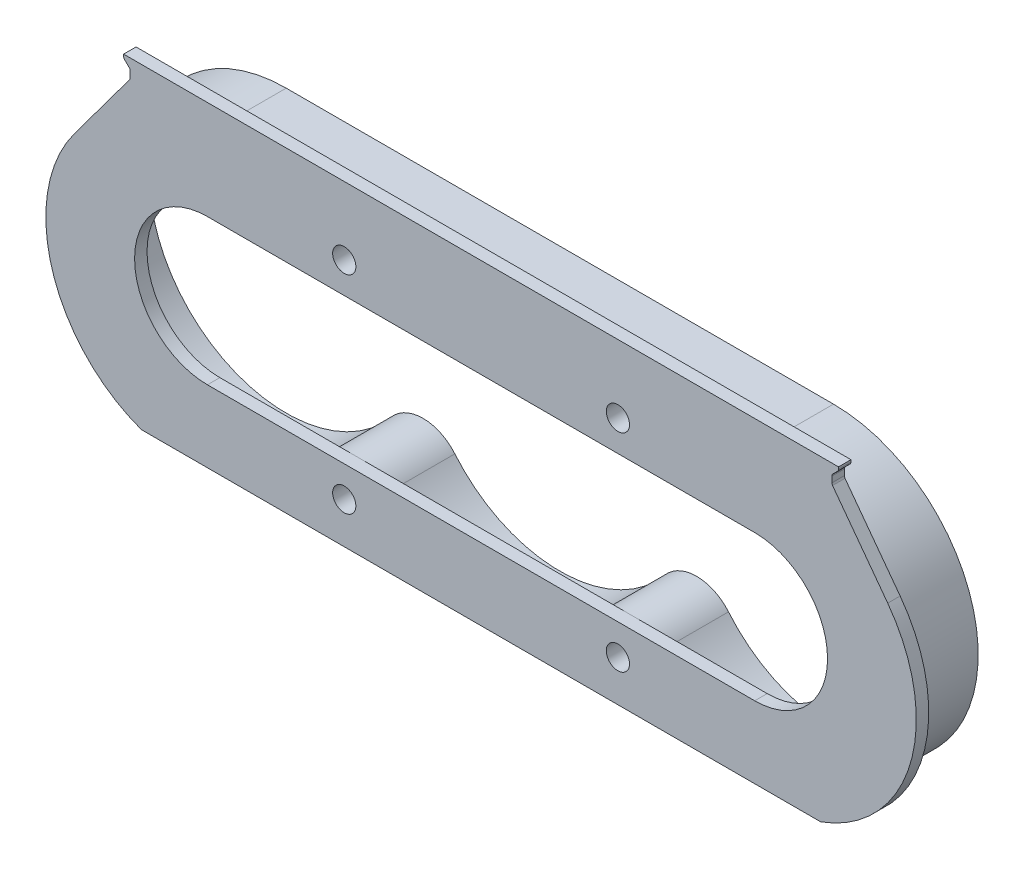
from build123d import *

# Parameters (mm, degrees)
SKETCH1_R               = 1.2
BOSS_EXTRUDE1_DEPTH     = 8
BOSS_EXTRUDE2_DEPTH     = 1.5
CUT_EXTRUDE1_DEPTH      = 125.252015178
CUT_EXTRUDE1_DEPTH_BACK = 125.252015178
SKETCH3_R               = 1.4
CUT_EXTRUDE2_DEPTH      = 125.252015178
SKETCH5_W               = 117.271867341
SKETCH5_H               = 6.016252737
CUT_EXTRUDE3_DEPTH      = 125.252015178


with BuildPart() as part:
    # Sketch1 → Boss-Extrude1 (new body)
    with BuildSketch(Plane.XY):
        with BuildLine():
            Line((32.794822831, -0.95), (98.794822831, -0.95))
            ThreePointArc((98.794822831, -0.95), (116.244822831, 16.5), (98.794822831, 33.95))
            Line((98.794822831, 33.95), (32.794822831, 33.95))
            ThreePointArc((32.794822831, 33.95), (15.344822831, 16.5), (32.794822831, -0.95))
        make_face()
        with Locations((82.294822831, 29)):
            Circle(SKETCH1_R, mode=Mode.SUBTRACT)
        with Locations((49.294822831, 4)):
            Circle(SKETCH1_R, mode=Mode.SUBTRACT)
        with Locations((82.294822831, 4)):
            Circle(SKETCH1_R, mode=Mode.SUBTRACT)
        with Locations((49.294822831, 29)):
            Circle(SKETCH1_R, mode=Mode.SUBTRACT)
        with BuildLine():
            ThreePointArc((86.132032133, 5.921543981), (82.294822831, 7.715951248), (78.457613529, 5.921543981))
            ThreePointArc((78.457613529, 5.921543981), (65.794822831, 0), (53.132032133, 5.921543981))
            ThreePointArc((53.132032133, 5.921543981), (49.294822831, 7.715951248), (45.457613529, 5.921543981))
            ThreePointArc((45.457613529, 5.921543981), (16.294822831, 16.5), (45.457613529, 27.078456019))
            ThreePointArc((45.457613529, 27.078456019), (49.294822831, 25.284048752), (53.132032133, 27.078456019))
            ThreePointArc((53.132032133, 27.078456019), (65.794822831, 33), (78.457613529, 27.078456019))
            ThreePointArc((78.457613529, 27.078456019), (82.294822831, 25.284048752), (86.132032133, 27.078456019))
            ThreePointArc((86.132032133, 27.078456019), (115.294822831, 16.5), (86.132032133, 5.921543981))
        make_face(mode=Mode.SUBTRACT)
    extrude(amount=BOSS_EXTRUDE1_DEPTH)

    # Sketch2 → Boss-Extrude2 (add)
    with BuildSketch(Plane.XY.offset(8)):
        with BuildLine():
            Line((30.807257811, -2), (100.782387851, -2))
            ThreePointArc((100.782387851, -2), (116.415253744, 7.634664408), (114.834700595, 25.929885261))
            Line((114.834700595, 25.929885261), (108.181498709, 34.893826024))
            ThreePointArc((108.181498709, 34.893826024), (108.122906141, 35.006681153), (108.102694429, 35.132223401))
            Line((108.102694429, 35.132223401), (108.102694429, 35.834314575))
            ThreePointArc((108.102694429, 35.834314575), (108.133142616, 35.987387948), (108.219851717, 36.117157288))
            Line((108.219851717, 36.117157288), (108.785537142, 36.682842712))
            ThreePointArc((108.785537142, 36.682842712), (108.872246242, 36.812612052), (108.902694429, 36.965685425))
            Line((108.902694429, 36.965685425), (108.902694429, 37.2))
            Line((108.902694429, 37.2), (22.686951233, 37.2))
            Line((22.686951233, 37.2), (22.686951233, 36.965685425))
            ThreePointArc((22.686951233, 36.965685425), (22.71739942, 36.812612052), (22.80410852, 36.682842712))
            Line((22.80410852, 36.682842712), (23.369793945, 36.117157288))
            ThreePointArc((23.369793945, 36.117157288), (23.456503046, 35.987387948), (23.486951233, 35.834314575))
            Line((23.486951233, 35.834314575), (23.486951233, 35.132223401))
            ThreePointArc((23.486951233, 35.132223401), (23.466739521, 35.006681153), (23.408146952, 34.893826024))
            Line((23.408146952, 34.893826024), (16.754945067, 25.929885261))
            ThreePointArc((16.754945067, 25.929885261), (15.174391918, 7.634664408), (30.807257811, -2))
        make_face()
    extrude(amount=BOSS_EXTRUDE2_DEPTH)

    # Sketch3 → Cut-Extrude1 (cut, two sides: drawn at the far end of the back side and taken through both)
    with BuildSketch(Plane(origin=(0, 0, 8), x_dir=(-1, 0, 0), z_dir=(0, 0, -1)).offset(-CUT_EXTRUDE1_DEPTH_BACK)):
        with Locations((-49.294822831, 29)):
            Circle(SKETCH3_R)
        with Locations((-49.294822831, 4)):
            Circle(SKETCH3_R)
        with Locations((-82.294822831, 4)):
            Circle(SKETCH3_R)
        with Locations((-82.294822831, 29)):
            Circle(SKETCH3_R)
    extrude(amount=CUT_EXTRUDE1_DEPTH + CUT_EXTRUDE1_DEPTH_BACK, mode=Mode.SUBTRACT)

    # Sketch4 → Cut-Extrude2 (cut, through all)
    with BuildSketch(Plane(origin=(0, 0, 8), x_dir=(-1, 0, 0), z_dir=(0, 0, -1))):
        with BuildLine():
            Line((-98.794822831, 25.284048752), (-32.794822831, 25.284048752))
            ThreePointArc((-32.794822831, 25.284048752), (-24.010774079, 16.5), (-32.794822831, 7.715951248))
            Line((-32.794822831, 7.715951248), (-98.794822831, 7.715951248))
            ThreePointArc((-98.794822831, 7.715951248), (-107.578871583, 16.5), (-98.794822831, 25.284048752))
        make_face()
    extrude(amount=-CUT_EXTRUDE2_DEPTH, mode=Mode.SUBTRACT)

    # Sketch5 → Cut-Extrude3 (cut, through all)
    with BuildSketch(Plane(origin=(0, 0, 8), x_dir=(-1, 0, 0), z_dir=(0, 0, -1))):
        with Locations((-71.069949673, -3.958126369)):
            Rectangle(SKETCH5_W, SKETCH5_H)
    extrude(amount=-CUT_EXTRUDE3_DEPTH, mode=Mode.SUBTRACT)


solid = part.part
